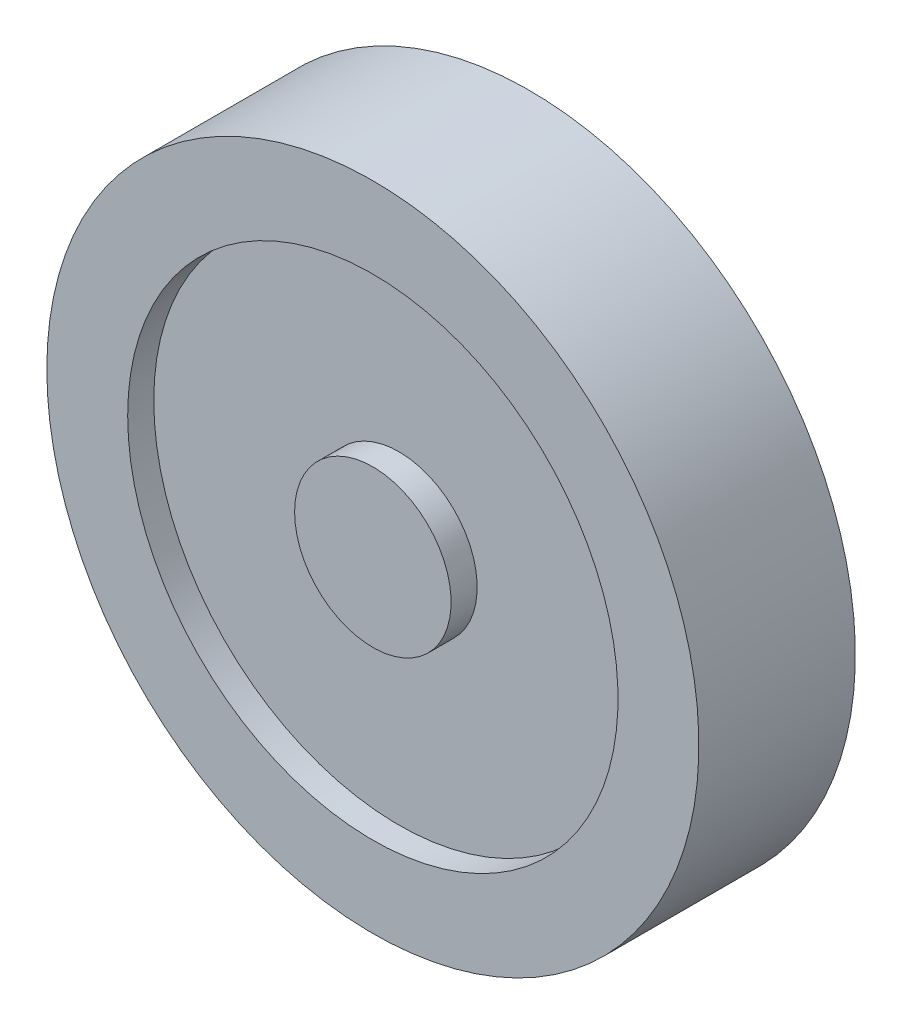
from build123d import *


with BuildPart() as part:
    # SK_P01_Wheel125x30 → P01_Wheel125x30 (revolve)
    with BuildSketch(Plane(origin=(0, 62.5, 0), x_dir=(1, 0, 0), z_dir=(0, 1, 0)), mode=Mode.PRIVATE) as p01_wheel125x30_sk:
        Polygon((0, 15), (15, 15), (15, 10), (47, 10), (47, 15), (62.5, 15), (62.5, -15), (47, -15), (47, -10), (15, -10), (15, -15), (0, -15), align=None)
    revolve(p01_wheel125x30_sk.sketch.rotate(Axis((0, 62.5, -20), (0, 0, 1)), 180), axis=Axis((0, 62.5, -20), (0, 0, 1)))


solid = part.part
